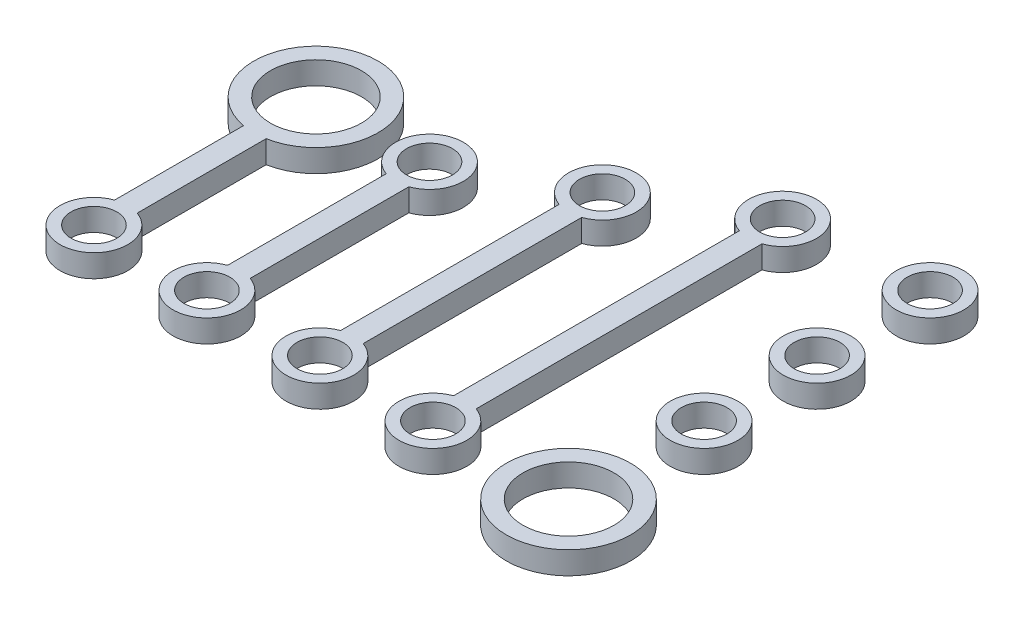
from build123d import *

# Parameters (mm, degrees)
SKETCH_1_R        = 11
SKETCH_1_R_2      = 8.05
EXTRUDE_1_DEPTH   = 4
SKETCH_1_R_3      = 6
SKETCH_1_R_4      = 4.05
EXTRUDE_1_2_DEPTH = 4
EXTRUDE_1_3_DEPTH = 4
EXTRUDE_1_4_DEPTH = 4
EXTRUDE_1_5_DEPTH = 4
EXTRUDE_1_6_DEPTH = 4
EXTRUDE_1_7_DEPTH = 4
EXTRUDE_1_8_DEPTH = 4


with BuildPart() as part:
    # Эскиз1 → Бобышка-Вытянуть1 (new body)
    with BuildSketch(Plane(origin=(0, 0, 0), x_dir=(1, 0, 0), z_dir=(0, 1, 0))):
        with Locations(Location((0, 0, 0), (0, 0, 270))):
            Circle(SKETCH_1_R)
        with Locations(Location((0, 0, 0), (0, 0, 270))):
            Circle(SKETCH_1_R_2, mode=Mode.SUBTRACT)
    extrude(amount=EXTRUDE_1_DEPTH)


with BuildPart() as body_2:
    # Эскиз1 → Extrude 1 2 (new body)
    with BuildSketch(Plane(origin=(0, 0, 0), x_dir=(1, 0, 0), z_dir=(0, 1, 0))):
        with Locations(Location((0, 24, 0), (0, 0, 270))):
            Circle(SKETCH_1_R_3)
        with Locations(Location((0, 24, 0), (0, 0, 270))):
            Circle(SKETCH_1_R_4, mode=Mode.SUBTRACT)
    extrude(amount=EXTRUDE_1_2_DEPTH)


with BuildPart() as body_3:
    # Эскиз1 → Extrude 1 3 (new body)
    with BuildSketch(Plane(origin=(0, 0, 0), x_dir=(1, 0, 0), z_dir=(0, 1, 0))):
        with Locations(Location((0, 64, 0), (0, 0, 270))):
            Circle(SKETCH_1_R_3)
        with Locations(Location((0, 64, 0), (0, 0, 270))):
            Circle(SKETCH_1_R_4, mode=Mode.SUBTRACT)
    extrude(amount=EXTRUDE_1_3_DEPTH)


with BuildPart() as body_4:
    # Эскиз1 → Extrude 1 4 (new body)
    with BuildSketch(Plane(origin=(0, 0, 0), x_dir=(1, 0, 0), z_dir=(0, 1, 0))):
        with Locations(Location((0, 44, 0), (0, 0, 270))):
            Circle(SKETCH_1_R_3)
        with Locations(Location((0, 44, 0), (0, 0, 270))):
            Circle(SKETCH_1_R_4, mode=Mode.SUBTRACT)
    extrude(amount=EXTRUDE_1_4_DEPTH)


with BuildPart() as body_5:
    # Эскиз1 → Extrude 1 5 (new body)
    with BuildSketch(Plane(origin=(0, 0, 0), x_dir=(1, 0, 0), z_dir=(0, 1, 0))):
        with BuildLine():
            Line((-86, 5.656854249), (-86, 28.483346174))
            ThreePointArc((-86, 28.483346174), (-84, 50.3), (-82, 28.483346174))
            Line((-82, 28.483346174), (-82, 5.656854249))
            ThreePointArc((-82, 5.656854249), (-84, -6), (-86, 5.656854249))
        make_face()
        with Locations(Location((-84, 39.3, 0), (0, 0, 270))):
            Circle(SKETCH_1_R_2, mode=Mode.SUBTRACT)
        with Locations(Location((-84, 0, 0), (0, 0, 270))):
            Circle(SKETCH_1_R_4, mode=Mode.SUBTRACT)
    extrude(amount=EXTRUDE_1_5_DEPTH)


with BuildPart() as body_6:
    # Эскиз1 → Extrude 1 6 (new body)
    with BuildSketch(Plane(origin=(0, 0, 0), x_dir=(1, 0, 0), z_dir=(0, 1, 0))):
        with BuildLine():
            Line((-66, 33.743145751), (-66, 5.656854249))
            ThreePointArc((-66, 5.656854249), (-64, -6), (-62, 5.656854249))
            Line((-62, 5.656854249), (-62, 33.743145751))
            ThreePointArc((-62, 33.743145751), (-64, 45.4), (-66, 33.743145751))
        make_face()
        with Locations(Location((-64, 39.4, 0), (0, 0, 270))):
            Circle(SKETCH_1_R_4, mode=Mode.SUBTRACT)
        with Locations(Location((-64, 0, 0), (0, 0, 270))):
            Circle(SKETCH_1_R_4, mode=Mode.SUBTRACT)
    extrude(amount=EXTRUDE_1_6_DEPTH)


with BuildPart() as body_7:
    # Эскиз1 → Extrude 1 7 (new body)
    with BuildSketch(Plane(origin=(0, 0, 0), x_dir=(1, 0, 0), z_dir=(0, 1, 0))):
        with BuildLine():
            Line((-26, 5.656854249), (-26, 56.243145751))
            ThreePointArc((-26, 56.243145751), (-24, 67.9), (-22, 56.243145751))
            Line((-22, 56.243145751), (-22, 5.656854249))
            ThreePointArc((-22, 5.656854249), (-24, -6), (-26, 5.656854249))
        make_face()
        with Locations(Location((-24, 0, 0), (0, 0, 270))):
            Circle(SKETCH_1_R_4, mode=Mode.SUBTRACT)
        with Locations(Location((-24, 61.9, 0), (0, 0, 270))):
            Circle(SKETCH_1_R_4, mode=Mode.SUBTRACT)
    extrude(amount=EXTRUDE_1_7_DEPTH)


with BuildPart() as body_8:
    # Эскиз1 → Extrude 1 8 (new body)
    with BuildSketch(Plane(origin=(0, 0, 0), x_dir=(1, 0, 0), z_dir=(0, 1, 0))):
        with BuildLine():
            Line((-46, 44.343145751), (-46, 5.656854249))
            ThreePointArc((-46, 5.656854249), (-44, -6), (-42, 5.656854249))
            Line((-42, 5.656854249), (-42, 44.343145751))
            ThreePointArc((-42, 44.343145751), (-44, 56), (-46, 44.343145751))
        make_face()
        with Locations(Location((-44, 0, 0), (0, 0, 270))):
            Circle(SKETCH_1_R_4, mode=Mode.SUBTRACT)
        with Locations(Location((-44, 50, 0), (0, 0, 270))):
            Circle(SKETCH_1_R_4, mode=Mode.SUBTRACT)
    extrude(amount=EXTRUDE_1_8_DEPTH)


solid = Compound([part.part, body_2.part, body_3.part, body_4.part, body_5.part, body_6.part, body_7.part, body_8.part])
